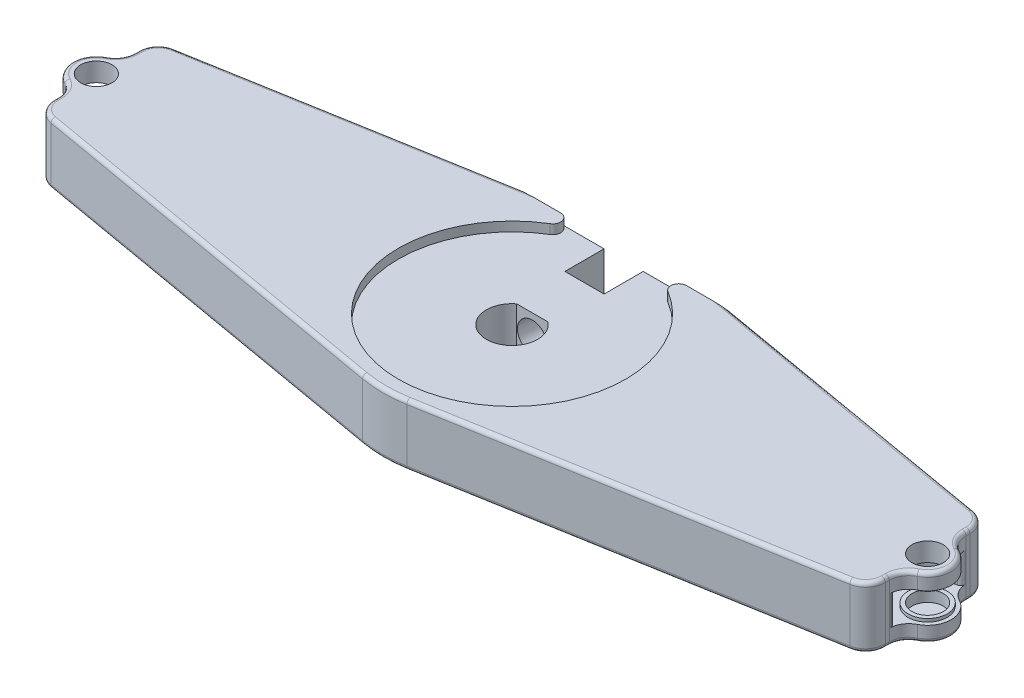
from build123d import *

# Parameters (mm, degrees)
BOSS_EXTRUDE1_DEPTH = 2
SKETCH2_R           = 2.5
BOSS_EXTRUDE2_DEPTH = 0.4
SKETCH3_R           = 2
BOSS_EXTRUDE3_DEPTH = 3
SKETCH5_R           = 2.5
BOSS_EXTRUDE4_DEPTH = 0.4
BOSS_EXTRUDE5_DEPTH = 3.8
BOSS_EXTRUDE6_DEPTH = 2
CUT_EXTRUDE1_DEPTH  = 59.965539936
SKETCH14_R          = 1.9
CUT_EXTRUDE6_DEPTH  = 59.965539936
SKETCH9_R           = 14.5
CUT_EXTRUDE3_DEPTH  = 1.2
FILLET1_R           = 0.5
SKETCH15_W          = 5
SKETCH15_H          = 6.6
CUT_EXTRUDE7_DEPTH  = 5
CUT_EXTRUDE5_START  = -1
SKETCH12_R          = 2
CUT_EXTRUDE5_DEPTH  = 58.96554006
FILLET4_R           = 1


with BuildPart() as part:
    # Sketch1 → Boss-Extrude1 (new body)
    with BuildSketch(Plane(origin=(0, 0, 0), x_dir=(1, 0, 0), z_dir=(0, 1, 0))):
        with BuildLine():
            Line((-53.07, -5.398003398), (-53.07, -4.898979486))
            ThreePointArc((-53.07, -4.898979486), (-53.437992836, -3.593397066), (-54.433636364, -2.672170628))
            ThreePointArc((-54.433636364, -2.672170628), (-56.07, 0), (-54.433636364, 2.672170628))
            ThreePointArc((-54.433636364, 2.672170628), (-53.437992836, 3.593397066), (-53.07, 4.898979486))
            Line((-53.07, 4.898979486), (-53.07, 5.398003398))
            ThreePointArc((-53.07, 5.398003398), (-52.483509318, 7.006879431), (-50.999214327, 7.860882822))
            Line((-50.999214327, 7.860882822), (-2.832814556, 16.255004205))
            ThreePointArc((-2.832814556, 16.255004205), (0, 16.5), (2.832814556, 16.255004205))
            Line((2.832814556, 16.255004205), (50.999214327, 7.860882822))
            ThreePointArc((50.999214327, 7.860882822), (52.483509318, 7.006879431), (53.07, 5.398003398))
            Line((53.07, 5.398003398), (53.07, 4.898979486))
            ThreePointArc((53.07, 4.898979486), (53.437992836, 3.593397066), (54.433636364, 2.672170628))
            ThreePointArc((54.433636364, 2.672170628), (56.07, 0), (54.433636364, -2.672170628))
            ThreePointArc((54.433636364, -2.672170628), (53.437992836, -3.593397066), (53.07, -4.898979486))
            Line((53.07, -4.898979486), (53.07, -5.398003398))
            ThreePointArc((53.07, -5.398003398), (52.483509318, -7.006879431), (50.999214327, -7.860882822))
            Line((50.999214327, -7.860882822), (2.832814556, -16.255004205))
            ThreePointArc((2.832814556, -16.255004205), (0, -16.5), (-2.832814556, -16.255004205))
            Line((-2.832814556, -16.255004205), (-50.999214327, -7.860882822))
            ThreePointArc((-50.999214327, -7.860882822), (-52.483509318, -7.006879431), (-53.07, -5.398003398))
        make_face()
        with BuildLine():
            Line((-1.997898896, 2.595), (1.997898896, 2.595))
            ThreePointArc((1.997898896, 2.595), (0, -3.275), (-1.997898896, 2.595))
        make_face(mode=Mode.SUBTRACT)
    extrude(amount=BOSS_EXTRUDE1_DEPTH)

    # Sketch2 → Boss-Extrude2 (add)
    with BuildSketch(Plane(origin=(0, 2, 0), x_dir=(1, 0, 0), z_dir=(0, 1, 0))):
        with Locations(Location((-53.07, 0, 0), (0, 0, 270))):
            Circle(SKETCH2_R)
        with Locations(Location((53.07, 0, 0), (0, 0, 270))):
            Circle(SKETCH2_R)
    extrude(amount=BOSS_EXTRUDE2_DEPTH)

    # Sketch3 → Boss-Extrude3 (add)
    with BuildSketch(Plane(origin=(0, 2.4, 0), x_dir=(1, 0, 0), z_dir=(0, 1, 0))):
        with Locations(Location((-53.07, 0, 0), (0, 0, 270))):
            Circle(SKETCH3_R)
        with Locations(Location((53.07, 0, 0), (0, 0, 270))):
            Circle(SKETCH3_R)
    extrude(amount=BOSS_EXTRUDE3_DEPTH)

    # Sketch5 → Boss-Extrude4 (add)
    with BuildSketch(Plane(origin=(0, 5.4, 0), x_dir=(1, 0, 0), z_dir=(0, 1, 0))):
        with Locations(Location((-53.07, 0, 0), (0, 0, 270))):
            Circle(SKETCH5_R)
        with Locations(Location((53.07, 0, 0), (0, 0, 270))):
            Circle(SKETCH5_R)
    extrude(amount=BOSS_EXTRUDE4_DEPTH)

    # Sketch4 → Boss-Extrude5 (add)
    with BuildSketch(Plane(origin=(0, 2, 0), x_dir=(1, 0, 0), z_dir=(0, 1, 0))):
        with BuildLine():
            Line((-53.07, 5.398003398), (-53.07, 4.898979486))
            ThreePointArc((-53.07, 4.898979486), (-53.071062452, 4.826101989), (-53.074248904, 4.753286436))
            ThreePointArc((-53.074248904, 4.753286436), (-52.95621099, 4.400491511), (-52.62719356, 4.226869108))
            ThreePointArc((-52.62719356, 4.226869108), (-48.82, 0), (-52.62719356, -4.226869108))
            ThreePointArc((-52.62719356, -4.226869108), (-52.95621099, -4.400491511), (-53.074248904, -4.753286436))
            ThreePointArc((-53.074248904, -4.753286436), (-53.071062452, -4.826101989), (-53.07, -4.898979486))
            Line((-53.07, -4.898979486), (-53.07, -5.398003398))
            ThreePointArc((-53.07, -5.398003398), (-52.483509318, -7.006879431), (-50.999214327, -7.860882822))
            Line((-50.999214327, -7.860882822), (-2.832814556, -16.255004205))
            ThreePointArc((-2.832814556, -16.255004205), (0, -16.5), (2.832814556, -16.255004205))
            Line((2.832814556, -16.255004205), (50.999214327, -7.860882822))
            ThreePointArc((50.999214327, -7.860882822), (52.483509318, -7.006879431), (53.07, -5.398003398))
            Line((53.07, -5.398003398), (53.07, -4.898979486))
            ThreePointArc((53.07, -4.898979486), (53.071062452, -4.826101989), (53.074248904, -4.753286436))
            ThreePointArc((53.074248904, -4.753286436), (52.95621099, -4.400491511), (52.62719356, -4.226869108))
            ThreePointArc((52.62719356, -4.226869108), (48.82, 0), (52.62719356, 4.226869108))
            ThreePointArc((52.62719356, 4.226869108), (52.95621099, 4.400491511), (53.074248904, 4.753286436))
            ThreePointArc((53.074248904, 4.753286436), (53.071062452, 4.826101989), (53.07, 4.898979486))
            Line((53.07, 4.898979486), (53.07, 5.398003398))
            ThreePointArc((53.07, 5.398003398), (52.483509318, 7.006879431), (50.999214327, 7.860882822))
            Line((50.999214327, 7.860882822), (2.832814556, 16.255004205))
            ThreePointArc((2.832814556, 16.255004205), (0, 16.5), (-2.832814556, 16.255004205))
            Line((-2.832814556, 16.255004205), (-50.999214327, 7.860882822))
            ThreePointArc((-50.999214327, 7.860882822), (-52.483509318, 7.006879431), (-53.07, 5.398003398))
        make_face()
        with BuildLine():
            Line((1.997898896, 2.595), (-1.997898896, 2.595))
            ThreePointArc((-1.997898896, 2.595), (0, -3.275), (1.997898896, 2.595))
        make_face(mode=Mode.SUBTRACT)
    extrude(amount=BOSS_EXTRUDE5_DEPTH)

    # Sketch6 → Boss-Extrude6 (add)
    with BuildSketch(Plane(origin=(0, 5.8, 0), x_dir=(1, 0, 0), z_dir=(0, 1, 0))):
        with BuildLine():
            Line((-2.832814556, 16.255004205), (-50.999214327, 7.860882822))
            ThreePointArc((-50.999214327, 7.860882822), (-52.483509318, 7.006879431), (-53.07, 5.398003398))
            Line((-53.07, 5.398003398), (-53.07, 4.898979486))
            ThreePointArc((-53.07, 4.898979486), (-53.437992836, 3.593397066), (-54.433636364, 2.672170628))
            ThreePointArc((-54.433636364, 2.672170628), (-56.07, 0), (-54.433636364, -2.672170628))
            ThreePointArc((-54.433636364, -2.672170628), (-53.437992836, -3.593397066), (-53.07, -4.898979486))
            Line((-53.07, -4.898979486), (-53.07, -5.398003398))
            ThreePointArc((-53.07, -5.398003398), (-52.483509318, -7.006879431), (-50.999214327, -7.860882822))
            Line((-50.999214327, -7.860882822), (-2.832814556, -16.255004205))
            ThreePointArc((-2.832814556, -16.255004205), (0, -16.5), (2.832814556, -16.255004205))
            Line((2.832814556, -16.255004205), (50.999214327, -7.860882822))
            ThreePointArc((50.999214327, -7.860882822), (52.483509318, -7.006879431), (53.07, -5.398003398))
            Line((53.07, -5.398003398), (53.07, -4.898979486))
            ThreePointArc((53.07, -4.898979486), (53.437992836, -3.593397066), (54.433636364, -2.672170628))
            ThreePointArc((54.433636364, -2.672170628), (56.07, 0), (54.433636364, 2.672170628))
            ThreePointArc((54.433636364, 2.672170628), (53.437992836, 3.593397066), (53.07, 4.898979486))
            Line((53.07, 4.898979486), (53.07, 5.398003398))
            ThreePointArc((53.07, 5.398003398), (52.483509318, 7.006879431), (50.999214327, 7.860882822))
            Line((50.999214327, 7.860882822), (2.832814556, 16.255004205))
            ThreePointArc((2.832814556, 16.255004205), (0, 16.5), (-2.832814556, 16.255004205))
        make_face()
        with BuildLine():
            Line((1.997898896, 2.595), (-1.997898896, 2.595))
            ThreePointArc((-1.997898896, 2.595), (0, -3.275), (1.997898896, 2.595))
        make_face(mode=Mode.SUBTRACT)
    extrude(amount=BOSS_EXTRUDE6_DEPTH)

    # Sketch7 → Cut-Extrude1 (cut, through all)
    with BuildSketch(Plane.XZ):
        with BuildLine():
            Line((-14.309036444, -14.255004205), (14.309036444, -14.255004205))
            Line((14.309036444, -14.255004205), (2.832814556, -16.255004205))
            ThreePointArc((2.832814556, -16.255004205), (0, -16.5), (-2.832814556, -16.255004205))
            Line((-2.832814556, -16.255004205), (-14.309036444, -14.255004205))
        make_face()
    extrude(amount=-CUT_EXTRUDE1_DEPTH, mode=Mode.SUBTRACT)

    # Sketch14 → Cut-Extrude6 (cut, through all)
    with BuildSketch(Plane.XY):
        with Locations((0, 3.9)):
            Circle(SKETCH14_R)
    extrude(amount=-CUT_EXTRUDE6_DEPTH, mode=Mode.SUBTRACT)

    # Sketch9 → Cut-Extrude3 (cut)
    with BuildSketch(Plane(origin=(0, 7.8, 0), x_dir=(1, 0, 0), z_dir=(0, 1, 0))):
        Circle(SKETCH9_R)
    extrude(amount=-CUT_EXTRUDE3_DEPTH, mode=Mode.SUBTRACT)

    # Fillet1
    fillet1_edges = [part.edges().sort_by_distance(p)[0] for p in [
        (-52.483509318, 7.8, -7.006879431),
        (-53.07, 7.8, -5.148491442),
        (-53.437992836, 7.8, -3.593397066),
        (-56.07, 7.8, 0),
        (-53.437992836, 7.8, 3.593397066),
        (-53.07, 7.8, 5.148491442),
        (-52.483509318, 7.8, 7.006879431),
        (-26.916014441, 7.8, 12.057943514),
        (0, 7.8, 16.5),
        (26.916014441, 7.8, 12.057943514),
        (52.483509318, 7.8, 7.006879431),
        (53.07, 7.8, 5.148491442),
        (53.437992836, 7.8, 3.593397066),
        (56.07, 7.8, 0),
        (53.437992836, 7.8, -3.593397066),
        (53.07, 7.8, -5.148491442),
        (52.483509318, 7.8, -7.006879431),
        (32.654125385, 7.8, -11.057943514),
        (-32.654125385, 7.8, -11.057943514),
        (-32.654125385, 0, -11.057943514),
        (32.654125385, 0, -11.057943514),
        (52.483509318, 0, -7.006879431),
        (53.07, 0, -5.148491442),
        (53.437992836, 0, -3.593397066),
        (56.07, 0, 0),
        (53.437992836, 0, 3.593397066),
        (53.07, 0, 5.148491442),
        (52.483509318, 0, 7.006879431),
        (26.916014441, 0, 12.057943514),
        (0, 0, 16.5),
        (-26.916014441, 0, 12.057943514),
        (-52.483509318, 0, 7.006879431),
        (-53.07, 0, 5.148491442),
        (-53.437992836, 0, 3.593397066),
        (-56.07, 0, 0),
        (-53.437992836, 0, -3.593397066),
        (-53.07, 0, -5.148491442),
        (-52.483509318, 0, -7.006879431),
    ]]
    fillet(fillet1_edges, radius=FILLET1_R)

    # Sketch15 → Cut-Extrude7 (cut)
    with BuildSketch(Plane(origin=(0, 0, -14.255004205), x_dir=(-1, 0, 0), z_dir=(0, 0, -1))):
        with Locations((0, 3.3)):
            Rectangle(SKETCH15_W, SKETCH15_H)
    extrude(amount=-CUT_EXTRUDE7_DEPTH, mode=Mode.SUBTRACT)

    # Sketch12 → Cut-Extrude5 (cut, through all)
    with BuildSketch(Plane.XZ.offset(CUT_EXTRUDE5_START)):
        with Locations(Location((-53.07, 0, 0), (0, 0, 270))):
            Circle(SKETCH12_R)
        with Locations(Location((53.07, 0, 0), (0, 0, 270))):
            Circle(SKETCH12_R)
    extrude(amount=-CUT_EXTRUDE5_DEPTH, mode=Mode.SUBTRACT)

    # Fillet4
    fillet4_edges = [part.edges().sort_by_distance(p)[0] for p in [
        (-2.654214597, 7.2, -14.255004205),
        (2.654214597, 7.2, -14.255004205),
    ]]
    fillet(fillet4_edges, radius=FILLET4_R)


solid = part.part
